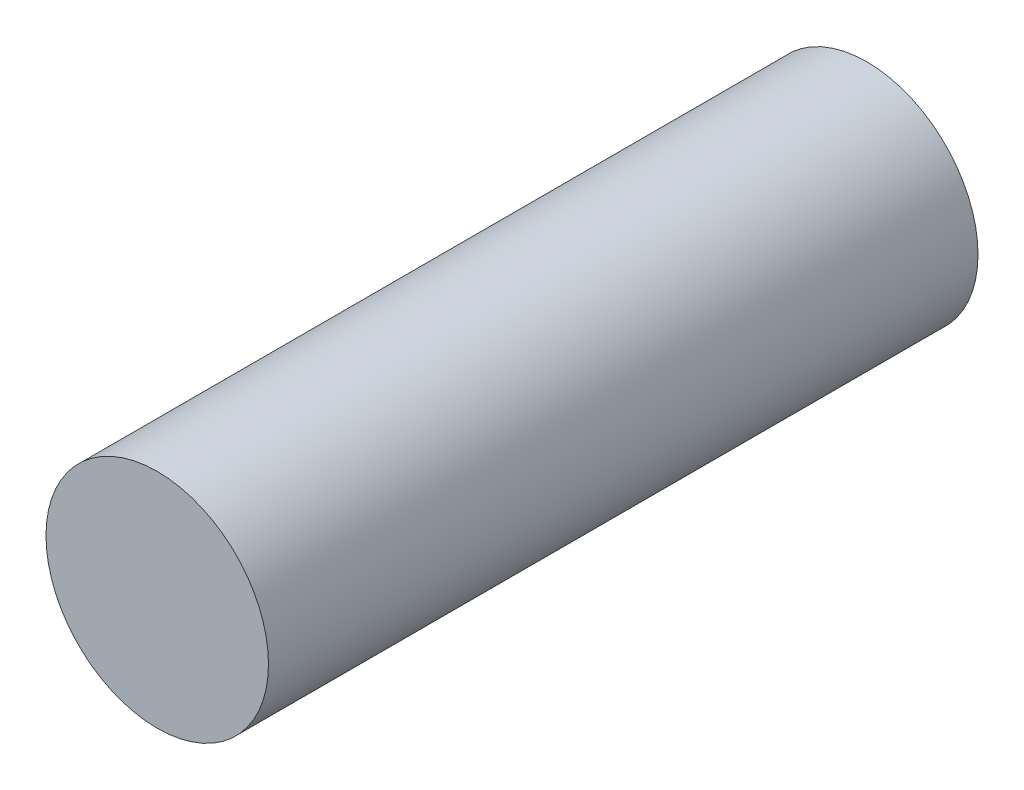
from build123d import *

# Parameters (mm, degrees)
SKETCH1_R           = 4.17
BOSS_EXTRUDE1_DEPTH = 13.3


with BuildPart() as part:
    # Sketch1 → Boss-Extrude1 (new, symmetric)
    with BuildSketch(Plane.XY):
        Circle(SKETCH1_R)
    extrude(amount=BOSS_EXTRUDE1_DEPTH, both=True)


solid = part.part
